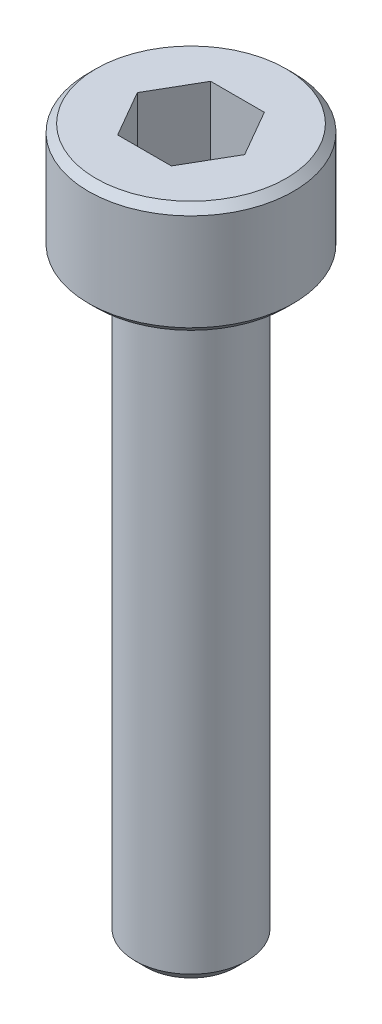
from build123d import *

# Parameters (mm, degrees)
CHAMFER_1_SIZE      = 0.2
CHAMFER_2_SIZE      = 0.3
CUT_EXTRUDE_1_DEPTH = 2.5


with BuildPart() as part:
    # 草图1 → 旋转1 (revolve)
    with BuildSketch(Plane.XY, mode=Mode.PRIVATE) as revolve_1_sk:
        Polygon((1.5, 0), (2.75, 0), (2.75, 3), (0, 3), (0, 0), (0, -16), (1.5, -16), align=None)
    revolve(revolve_1_sk.sketch.rotate(Axis((0, 3, 0), (0, -1, 0)), 90), axis=Axis((0, 3, 0), (0, -1, 0)))

    # 倒角1
    chamfer_1_edges = [part.edges().sort_by_distance(p)[0] for p in [
        (0, 3, -2.75),
        (0, 0, -2.75),
    ]]
    chamfer(chamfer_1_edges, length=CHAMFER_1_SIZE)

    # 倒角2
    chamfer_2_edges = [part.edges().sort_by_distance(p)[0] for p in [
        (0, -16, -1.5),
    ]]
    chamfer(chamfer_2_edges, length=CHAMFER_2_SIZE)

    # 草图2 → 切除-拉伸1 (cut)
    with BuildSketch(Plane(origin=(0, 3, 0), x_dir=(1, 0, 0), z_dir=(0, 1, 0))):
        Polygon((-0.72, 1.247076581), (0.72, 1.247076581), (1.44, 0), (0.72, -1.247076581), (-0.72, -1.247076581), (-1.44, 0), align=None)
    extrude(amount=-CUT_EXTRUDE_1_DEPTH, mode=Mode.SUBTRACT)


solid = part.part
